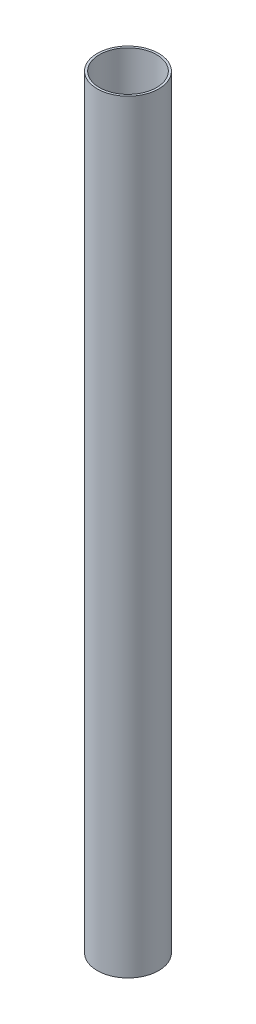
from build123d import *

# Parameters (mm, degrees)
SKETCH1_R           = 19.05
SKETCH1_R_2         = 17.69872
EXTRUDE_THIN1_DEPTH = 473.202


with BuildPart() as part:
    # Sketch1 → Extrude-Thin1 (new body)
    with BuildSketch(Plane(origin=(0, 0, 0), x_dir=(1, 0, 0), z_dir=(0, 1, 0))):
        Circle(SKETCH1_R)
        Circle(SKETCH1_R_2, mode=Mode.SUBTRACT)
    extrude(amount=EXTRUDE_THIN1_DEPTH)


solid = part.part
